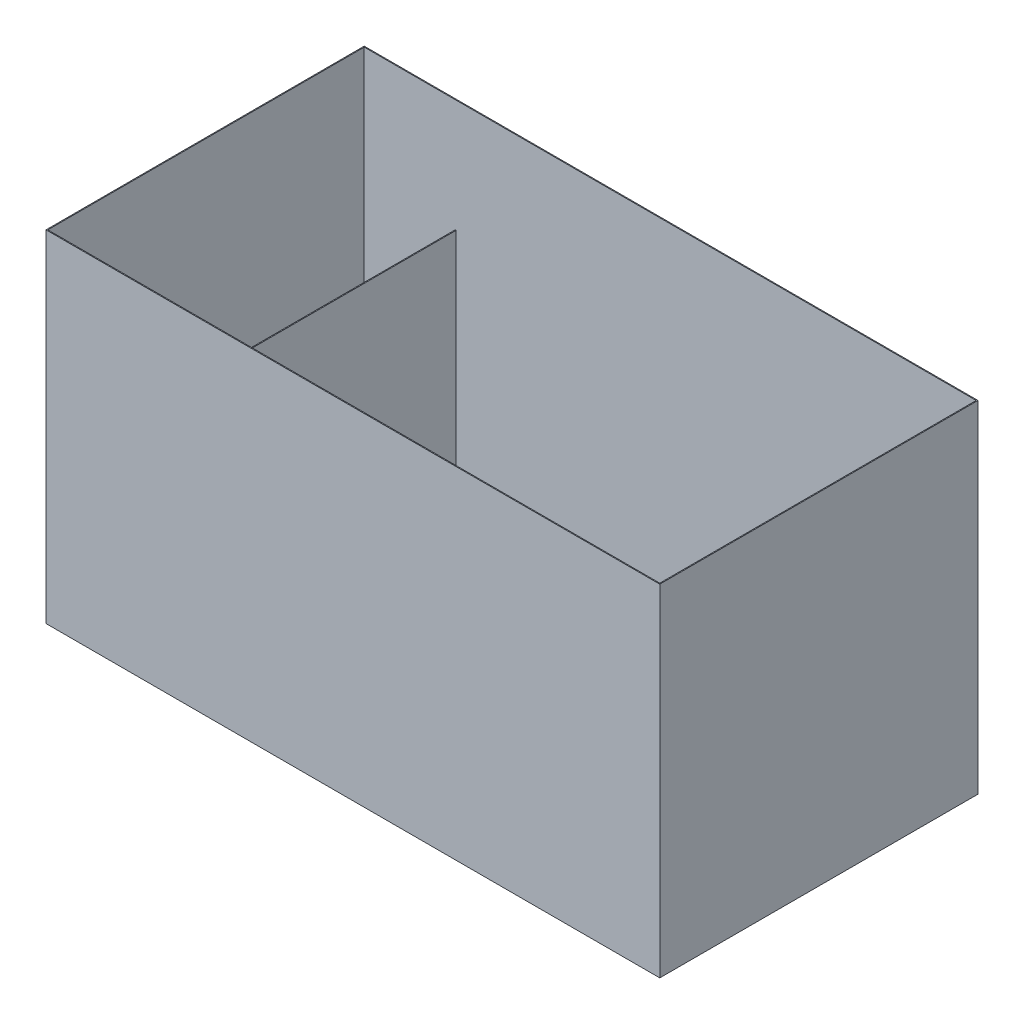
from build123d import *

# Parameters (mm, degrees)
MASTER_FOOTPRINT_W     = 1350
MASTER_FOOTPRINT_H     = 700
BATH_BASE_PLATE_DEPTH  = 750
BATH_SHELL_2MM_T       = -2
ORIENTATION_TEST_START = 250
SKETCH_1_W             = 600
SKETCH_1_H             = 450
ORIENTATION_TEST_DEPTH = 2


with BuildPart() as part:
    # MASTER_FOOTPRINT → BATH_BASE_PLATE (new body)
    with BuildSketch(Plane(origin=(0, 0, 0), x_dir=(1, 0, 0), z_dir=(0, 1, 0))):
        with Locations((675, 350)):
            Rectangle(MASTER_FOOTPRINT_W, MASTER_FOOTPRINT_H)
    extrude(amount=BATH_BASE_PLATE_DEPTH)

    # BATH_SHELL_2MM
    bath_shell_2mm_openings = [part.faces().sort_by_distance(p)[0] for p in [
        (675, 750, -350),
    ]]
    offset(amount=BATH_SHELL_2MM_T, openings=bath_shell_2mm_openings, kind=Kind.INTERSECTION)


with BuildPart() as body_2:
    # Эскиз1 → ORIENTATION_TEST (new body)
    with BuildSketch(Plane(origin=(0, 0, 0), x_dir=(0, 0, -1), z_dir=(1, 0, 0)).offset(ORIENTATION_TEST_START)):
        with Locations((350, 325)):
            Rectangle(SKETCH_1_W, SKETCH_1_H)
    extrude(amount=ORIENTATION_TEST_DEPTH)


solid = Compound([part.part, body_2.part])
